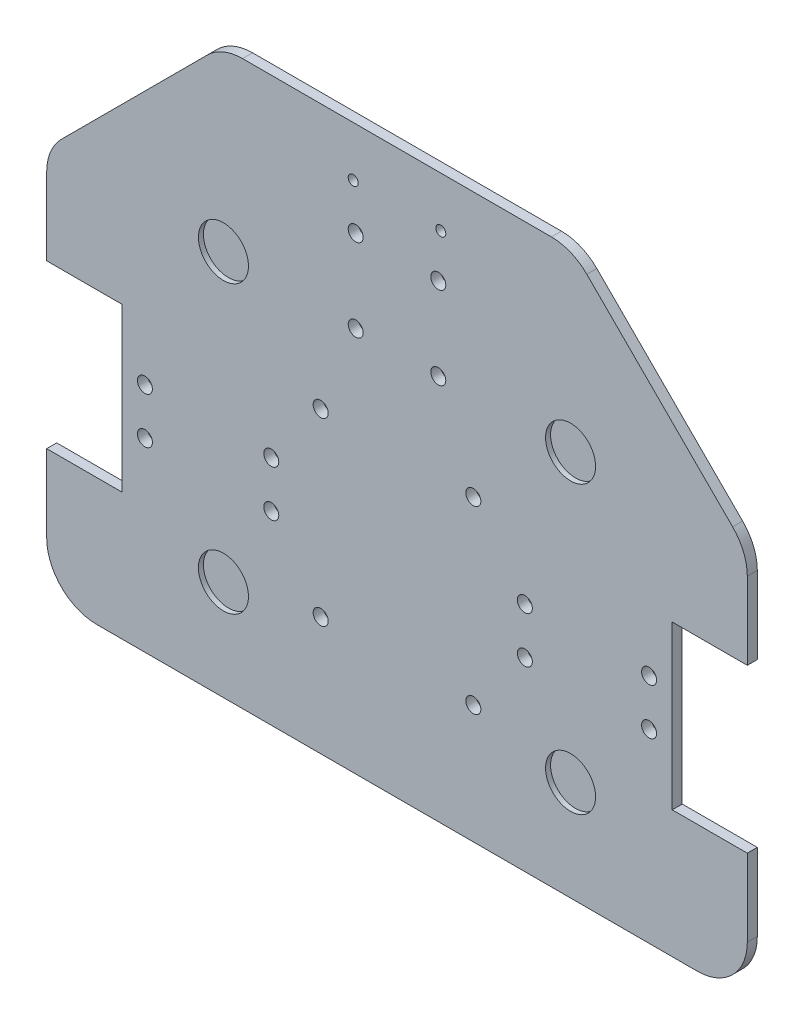
from build123d import *

# Parameters (mm, degrees)
EXTRUDE_1_DEPTH      = 4
SKETCH_1950_R        = 3
CUT_EXTRUDE_3_DEPTH  = 10
L298N_R              = 3
CUT_EXTRUDE_5_DEPTH  = 10
SKETCH_486_R         = 3
CUT_EXTRUDE_7_DEPTH  = 10
CUT_EXTRUDE_8_DEPTH  = 10
SKETCH_2788_R        = 2
CUT_EXTRUDE_10_DEPTH = 10
SKETCH_11_R          = 10
CUT_EXTRUDE_11_DEPTH = 2


with BuildPart() as part:
    # 草图3 → 凸台-拉伸1 (new body)
    with BuildSketch(Plane.XY):
        with BuildLine():
            Line((73.505746565, 259.089488009), (196.937204075, 259.089488009))
            ThreePointArc((196.937204075, 259.089488009), (204.590872722, 257.56707866), (211.079339699, 253.231623633))
            Line((211.079339699, 253.231623633), (269.363610946, 194.947352386))
            ThreePointArc((269.363610946, 194.947352386), (273.699065973, 188.458885409), (275.221475323, 180.805216762))
            Line((275.221475323, 180.805216762), (275.221475323, 54.089488009))
            ThreePointArc((275.221475323, 54.089488009), (269.363610946, 39.947352386), (255.221475323, 34.089488009))
            Line((255.221475323, 34.089488009), (15.221475318, 34.089488009))
            ThreePointArc((15.221475318, 34.089488009), (1.079339694, 39.947352386), (-4.778524682, 54.089488009))
            Line((-4.778524682, 54.089488009), (-4.778524682, 180.805216762))
            ThreePointArc((-4.778524682, 180.805216762), (-3.256115333, 188.458885409), (1.079339694, 194.947352386))
            Line((1.079339694, 194.947352386), (59.363610941, 253.231623633))
            ThreePointArc((59.363610941, 253.231623633), (65.852077918, 257.56707866), (73.505746565, 259.089488009))
        make_face()
    extrude(amount=EXTRUDE_1_DEPTH)

    # Sketch 1950 → 切除-拉伸3 (cut)
    with BuildSketch(Plane.XY):
        with Locations((235.971475323, 126.697352386)):
            Circle(SKETCH_1950_R)
        with Locations((186.316790846, 126.697352386)):
            Circle(SKETCH_1950_R)
        with Locations((84.971475318, 108.197352386)):
            Circle(SKETCH_1950_R)
        with Locations((235.971475323, 108.197352386)):
            Circle(SKETCH_1950_R)
        with Locations(Location((186.316790846, 108.197352386, 0), (0, 0, 180))):
            Circle(SKETCH_1950_R)
        with Locations(Location((84.971475318, 126.697352386, 0), (0, 0, 180))):
            Circle(SKETCH_1950_R)
        with Locations((34.471475318, 126.697352386)):
            Circle(SKETCH_1950_R)
        with Locations(Location((34.471475318, 108.197352386, 0), (0, 0, 180))):
            Circle(SKETCH_1950_R)
    extrude(amount=CUT_EXTRUDE_3_DEPTH, mode=Mode.SUBTRACT)

    # L298N → 切除-拉伸5 (cut)
    with BuildSketch(Plane.XY):
        with Locations((118.72147532, 188.268420197)):
            Circle(L298N_R)
        with Locations((118.72147532, 221.268420197)):
            Circle(L298N_R)
        with Locations((151.72147532, 221.268420197)):
            Circle(L298N_R)
        with Locations((151.72147532, 188.268420197)):
            Circle(L298N_R)
    extrude(amount=CUT_EXTRUDE_5_DEPTH, mode=Mode.SUBTRACT)

    # Sketch 486 → 切除-拉伸7 (cut)
    with BuildSketch(Plane.XY):
        with Locations((104.72147532, 153.447352386)):
            Circle(SKETCH_486_R)
        with Locations((104.72147532, 81.447352386)):
            Circle(SKETCH_486_R)
        with Locations((165.72147532, 81.447352386)):
            Circle(SKETCH_486_R)
        with Locations((165.72147532, 153.447352386)):
            Circle(SKETCH_486_R)
    extrude(amount=CUT_EXTRUDE_7_DEPTH, mode=Mode.SUBTRACT)

    # Sketch 1082 → 切除-拉伸8 (cut)
    with BuildSketch(Plane.XY.offset(4)):
        Polygon((-4.778524682, 149.947352386), (-4.778524682, 84.947352386), (25.221475318, 84.947352386), (25.221475318, 149.947352386), (7.221475318, 149.947352386), align=None)
        Polygon((245.221475323, 149.947352386), (245.221475323, 84.947352386), (275.221475323, 84.947352386), (275.221475323, 149.947352386), (263.221475323, 149.947352386), align=None)
    extrude(amount=-CUT_EXTRUDE_8_DEPTH, mode=Mode.SUBTRACT)

    # Sketch 2788 → 切除-拉伸10 (cut)
    with BuildSketch(Plane.XY):
        with Locations((117.72147532, 239.089488009)):
            Circle(SKETCH_2788_R)
        with Locations((152.72147532, 239.089488009)):
            Circle(SKETCH_2788_R)
    extrude(amount=CUT_EXTRUDE_10_DEPTH, mode=Mode.SUBTRACT)

    # 草图11 → 切除-拉伸11 (cut)
    with BuildSketch(Plane.XY.offset(4)):
        with Locations((65.852077918, 188.458885409)):
            Circle(SKETCH_11_R)
        with Locations((204.590872722, 188.458885409)):
            Circle(SKETCH_11_R)
        with Locations((65.852077918, 74.089488009)):
            Circle(SKETCH_11_R)
        with Locations((204.590872722, 74.089488009)):
            Circle(SKETCH_11_R)
    extrude(amount=-CUT_EXTRUDE_11_DEPTH, mode=Mode.SUBTRACT)


solid = part.part
